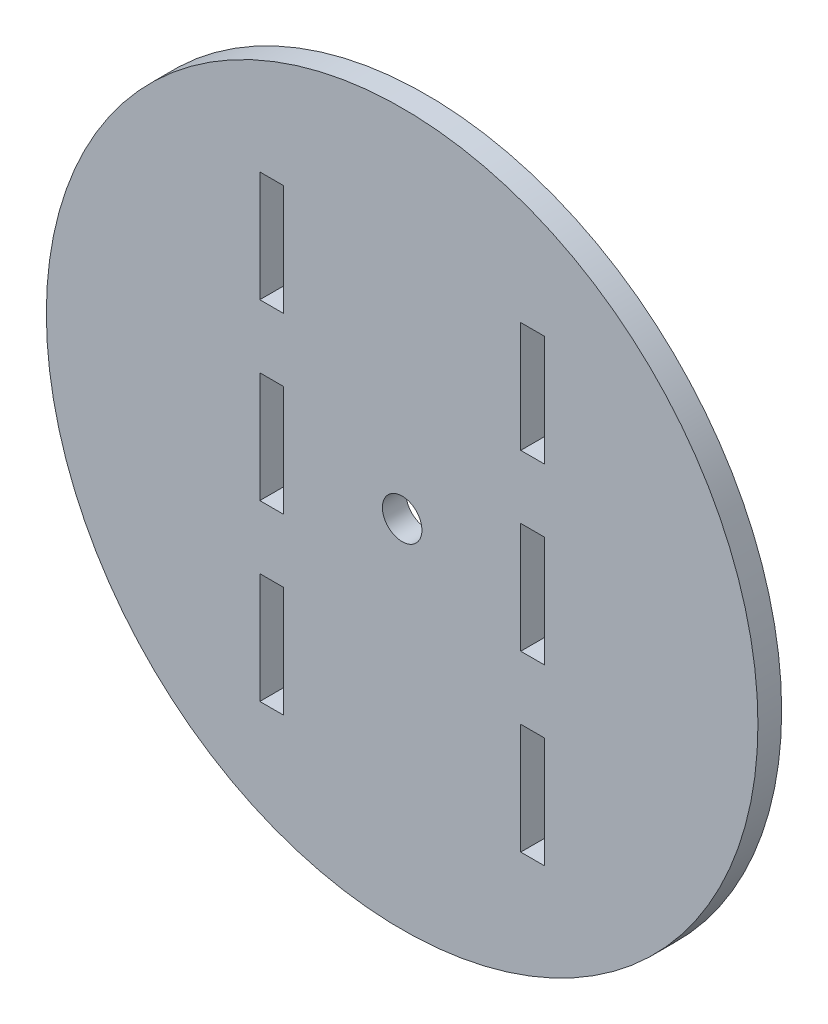
from build123d import *

# Parameters (mm, degrees)
SKETCH1_R           = 45
BOSS_EXTRUDE1_DEPTH = 3
SKETCH2_R           = 2.5
SKETCH2_W           = 3
SKETCH2_H           = 14
CUT_EXTRUDE3_DEPTH  = 35


with BuildPart() as part:
    # Sketch1 → Boss-Extrude1 (new body)
    with BuildSketch(Plane.XY):
        with Locations((45, 147.5080997)):
            Circle(SKETCH1_R)
    extrude(amount=BOSS_EXTRUDE1_DEPTH)

    # Sketch2 → Cut-Extrude3 (cut)
    with BuildSketch(Plane.XY):
        with Locations((45, 147.5080997)):
            Circle(SKETCH2_R)
        with Locations((61.5, 169.5080997)):
            Rectangle(SKETCH2_W, SKETCH2_H)
        with Locations((61.5, 147.5080997)):
            Rectangle(SKETCH2_W, SKETCH2_H)
        with Locations((61.5, 125.5080997)):
            Rectangle(SKETCH2_W, SKETCH2_H)
        with Locations((28.5, 169.5080997)):
            Rectangle(SKETCH2_W, SKETCH2_H)
        with Locations((28.5, 125.5080997)):
            Rectangle(SKETCH2_W, SKETCH2_H)
        with Locations((28.5, 147.5080997)):
            Rectangle(SKETCH2_W, SKETCH2_H)
    extrude(amount=CUT_EXTRUDE3_DEPTH, mode=Mode.SUBTRACT)


solid = part.part
